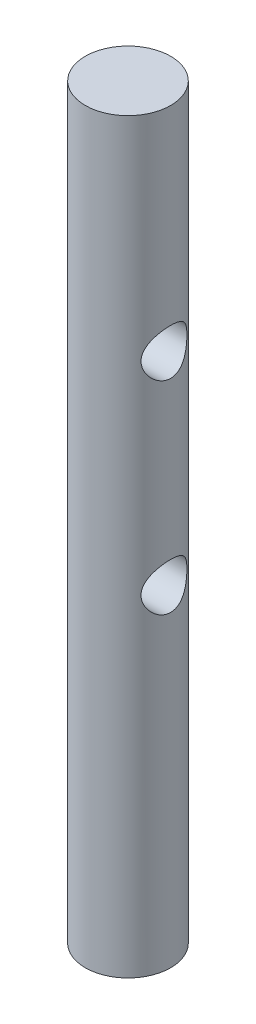
from build123d import *

# Parameters (mm, degrees)
SKETCH1_R            = 4
BOSS_EXTRUDE1_DEPTH  = 70
M4_CLEARANCE_HOLE1_D = 4.3


with BuildPart() as part:
    # Sketch1 → Boss-Extrude1 (new body)
    with BuildSketch(Plane(origin=(0, 0, 0), x_dir=(1, 0, 0), z_dir=(0, 1, 0))):
        with Locations(Location((0, 0, 0), (0, 0, 270))):
            Circle(SKETCH1_R)
    extrude(amount=BOSS_EXTRUDE1_DEPTH)

    # M4 Clearance Hole1 (through all)
    with Locations(Plane(origin=(4, 0, 0), x_dir=(0, 0, -1), z_dir=(1, 0, 0))):
        with Locations((0, 50), (0, 31)):
            Hole(M4_CLEARANCE_HOLE1_D / 2)


solid = part.part
